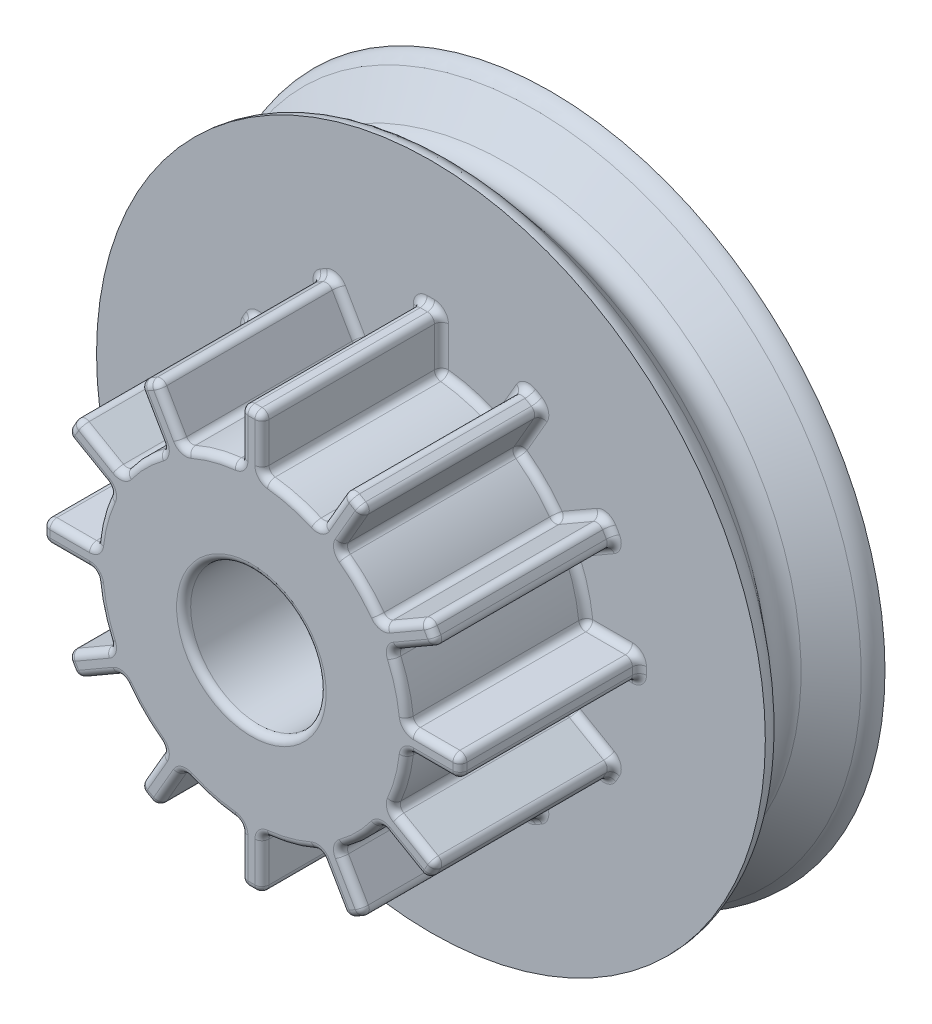
from build123d import *

# Parameters (mm, degrees)
CUT_EXTRUDE1_START = -10.2
CUT_EXTRUDE1_DEPTH = 10.2
CIRPATTERN1_COUNT  = 12
FILLET2_R          = 0.4
SKETCH4_R          = 14
SKETCH4_R_2        = 7
CUT_EXTRUDE2_DEPTH = 4.4
FILLET3_R          = 1.6


with BuildPart() as part:
    # Sketch2 → Revolve1 (revolve)
    with BuildSketch(Plane(origin=(0, 0, 0), x_dir=(0, 0, -1), z_dir=(1, 0, 0)), mode=Mode.PRIVATE) as revolve1_sk:
        with BuildLine():
            Line((0, 3.85), (-17, 3.85))
            Line((-17, 3.85), (-17, 11.85))
            Line((-17, 11.85), (-6.8, 11.85))
            Line((-6.8, 11.85), (-6.8, 19))
            ThreePointArc((-6.8, 19), (-6.292858086, 18.887569344), (-5.880746668, 18.571345132))
            Line((-5.880746668, 18.571345132), (-4.319253332, 16.710429838))
            ThreePointArc((-4.319253332, 16.710429838), (-3.4, 16.28177497), (-2.480746668, 16.710429838))
            Line((-2.480746668, 16.710429838), (-0.919253332, 18.571345132))
            ThreePointArc((-0.919253332, 18.571345132), (-0.507141914, 18.887569344), (0, 19))
            Line((0, 19), (0, 3.85))
        make_face()
    revolve(revolve1_sk.sketch.rotate(Axis((0, 0, 0), (0, 0, 1)), 90), axis=Axis((0, 0, 0), (0, 0, 1)))

    # Sketch3 → Cut-Extrude1 (cut)
    with BuildSketch(Plane.XY.offset(17).offset(CUT_EXTRUDE1_START)):
        with BuildLine():
            ThreePointArc((5.397784947, 10.549237777), (3.067005684, 11.446221042), (0.6, 11.834800379))
            Line((0.6, 11.834800379), (0.6, 8.829637592))
            ThreePointArc((0.6, 8.829637592), (2.290548549, 8.548443563), (3.895203554, 7.946690461))
            Line((3.895203554, 7.946690461), (5.397784947, 10.549237777))
        make_face()
    cut_extrude1 = extrude(amount=CUT_EXTRUDE1_DEPTH, mode=Mode.SUBTRACT)

    # CirPattern1: Cut-Extrude1 ×12 about axis
    cirpattern1_axis = Axis((0, 0, 0), (0, 0, 1))
    for i in range(1, CIRPATTERN1_COUNT):
        add(cut_extrude1.rotate(cirpattern1_axis, i * 360 / CIRPATTERN1_COUNT), mode=Mode.SUBTRACT)

    # Fillet2
    fillet2_edges = [part.edges().sort_by_distance(p)[0] for p in [
        (3.85, 0, 17),
        (3.85, 0, 0),
        (-11.834800379, 0.6, 11.9),
        (-10.549237777, 5.397784947, 11.9),
        (-8.829637592, 0.6, 11.9),
        (-7.946690461, 3.895203554, 11.9),
        (-10.332218985, 0.6, 17),
        (-8.548443563, 2.290548549, 17),
        (-9.247964119, 4.64649425, 17),
        (-10.332218985, 0.6, 6.8),
        (-9.247964119, 4.64649425, 6.8),
        (-8.548443563, 2.290548549, 6.8),
        (-5.397784947, 10.549237777, 11.9),
        (-0.6, 11.834800379, 11.9),
        (-3.895203554, 7.946690461, 11.9),
        (-0.6, 8.829637592, 11.9),
        (-4.64649425, 9.247964119, 17),
        (-2.290548549, 8.548443563, 17),
        (-0.6, 10.332218985, 17),
        (-4.64649425, 9.247964119, 6.8),
        (-0.6, 10.332218985, 6.8),
        (-2.290548549, 8.548443563, 6.8),
        (-9.949237777, 6.437015432, 11.9),
        (-6.437015432, 9.949237777, 11.9),
        (-7.346690461, 4.934434038, 11.9),
        (-4.934434038, 7.346690461, 11.9),
        (-8.647964119, 5.685724735, 17),
        (-6.257895014, 6.257895014, 17),
        (-5.685724735, 8.647964119, 17),
        (-8.647964119, 5.685724735, 6.8),
        (-5.685724735, 8.647964119, 6.8),
        (-6.257895014, 6.257895014, 6.8),
        (-6.437015432, -9.949237777, 11.9),
        (-9.949237777, -6.437015432, 11.9),
        (-4.934434038, -7.346690461, 11.9),
        (-7.346690461, -4.934434038, 11.9),
        (-5.685724735, -8.647964119, 17),
        (-6.257895014, -6.257895014, 17),
        (-8.647964119, -5.685724735, 17),
        (-5.685724735, -8.647964119, 6.8),
        (-8.647964119, -5.685724735, 6.8),
        (-6.257895014, -6.257895014, 6.8),
        (-10.549237777, -5.397784947, 11.9),
        (-11.834800379, -0.6, 11.9),
        (-7.946690461, -3.895203554, 11.9),
        (-8.829637592, -0.6, 11.9),
        (-9.247964119, -4.64649425, 17),
        (-8.548443563, -2.290548549, 17),
        (-10.332218985, -0.6, 17),
        (-9.247964119, -4.64649425, 6.8),
        (-10.332218985, -0.6, 6.8),
        (-8.548443563, -2.290548549, 6.8),
        (10.549237777, 5.397784947, 11.9),
        (11.834800379, 0.6, 11.9),
        (7.946690461, 3.895203554, 11.9),
        (8.829637592, 0.6, 11.9),
        (9.247964119, 4.64649425, 17),
        (8.548443563, 2.290548549, 17),
        (10.332218985, 0.6, 17),
        (9.247964119, 4.64649425, 6.8),
        (10.332218985, 0.6, 6.8),
        (8.548443563, 2.290548549, 6.8),
        (11.834800379, -0.6, 11.9),
        (10.549237777, -5.397784947, 11.9),
        (8.829637592, -0.6, 11.9),
        (7.946690461, -3.895203554, 11.9),
        (10.332218985, -0.6, 17),
        (8.548443563, -2.290548549, 17),
        (9.247964119, -4.64649425, 17),
        (10.332218985, -0.6, 6.8),
        (9.247964119, -4.64649425, 6.8),
        (8.548443563, -2.290548549, 6.8),
        (-0.6, -11.834800379, 11.9),
        (-5.397784947, -10.549237777, 11.9),
        (-0.6, -8.829637592, 11.9),
        (-3.895203554, -7.946690461, 11.9),
        (-0.6, -10.332218985, 17),
        (-2.290548549, -8.548443563, 17),
        (-4.64649425, -9.247964119, 17),
        (-0.6, -10.332218985, 6.8),
        (-4.64649425, -9.247964119, 6.8),
        (-2.290548549, -8.548443563, 6.8),
        (5.397784947, -10.549237777, 11.9),
        (0.6, -11.834800379, 11.9),
        (3.895203554, -7.946690461, 11.9),
        (0.6, -8.829637592, 11.9),
        (4.64649425, -9.247964119, 17),
        (2.290548549, -8.548443563, 17),
        (0.6, -10.332218985, 17),
        (4.64649425, -9.247964119, 6.8),
        (0.6, -10.332218985, 6.8),
        (2.290548549, -8.548443563, 6.8),
        (9.949237777, -6.437015432, 11.9),
        (6.437015432, -9.949237777, 11.9),
        (7.346690461, -4.934434038, 11.9),
        (4.934434038, -7.346690461, 11.9),
        (8.647964119, -5.685724735, 17),
        (6.257895014, -6.257895014, 17),
        (5.685724735, -8.647964119, 17),
        (8.647964119, -5.685724735, 6.8),
        (5.685724735, -8.647964119, 6.8),
        (6.257895014, -6.257895014, 6.8),
        (5.925, 10.262401035, 6.8),
        (5.925, 10.262401035, 17),
        (0.6, 11.834800379, 11.9),
        (5.397784947, 10.549237777, 11.9),
        (0.6, 8.829637592, 11.9),
        (3.895203554, 7.946690461, 11.9),
        (0.6, 10.332218985, 17),
        (2.290548549, 8.548443563, 17),
        (4.64649425, 9.247964119, 17),
        (0.6, 10.332218985, 6.8),
        (4.64649425, 9.247964119, 6.8),
        (2.290548549, 8.548443563, 6.8),
        (10.262401035, 5.925, 6.8),
        (10.262401035, 5.925, 17),
        (6.437015432, 9.949237777, 11.9),
        (9.949237777, 6.437015432, 11.9),
        (4.934434038, 7.346690461, 11.9),
        (7.346690461, 4.934434038, 11.9),
        (5.685724735, 8.647964119, 17),
        (6.257895014, 6.257895014, 17),
        (8.647964119, 5.685724735, 17),
        (5.685724735, 8.647964119, 6.8),
        (8.647964119, 5.685724735, 6.8),
        (6.257895014, 6.257895014, 6.8),
        (11.85, 0, 6.8),
        (10.262401035, -5.925, 6.8),
        (5.925, -10.262401035, 6.8),
        (0, -11.85, 6.8),
        (-5.925, -10.262401035, 6.8),
        (-10.262401035, -5.925, 6.8),
        (-11.85, 0, 6.8),
        (-10.262401035, 5.925, 6.8),
        (-5.925, 10.262401035, 6.8),
        (0, 11.85, 6.8),
        (11.85, 0, 17),
        (10.262401035, -5.925, 17),
        (5.925, -10.262401035, 17),
        (0, -11.85, 17),
        (-5.925, -10.262401035, 17),
        (-10.262401035, -5.925, 17),
        (-11.85, 0, 17),
        (-10.262401035, 5.925, 17),
        (-5.925, 10.262401035, 17),
        (0, 11.85, 17),
    ]]
    fillet(fillet2_edges, radius=FILLET2_R)

    # Sketch4 → Cut-Extrude2 (cut)
    with BuildSketch(Plane(origin=(0, 0, 0), x_dir=(-1, 0, 0), z_dir=(0, 0, -1))):
        Circle(SKETCH4_R)
        Circle(SKETCH4_R_2, mode=Mode.SUBTRACT)
    extrude(amount=-CUT_EXTRUDE2_DEPTH, mode=Mode.SUBTRACT)

    # Fillet3
    fillet3_edges = [part.edges().sort_by_distance(p)[0] for p in [
        (14, 0, 4.4),
        (7, 0, 0),
        (14, 0, 0),
        (7, 0, 4.4),
    ]]
    fillet(fillet3_edges, radius=FILLET3_R)


solid = part.part
